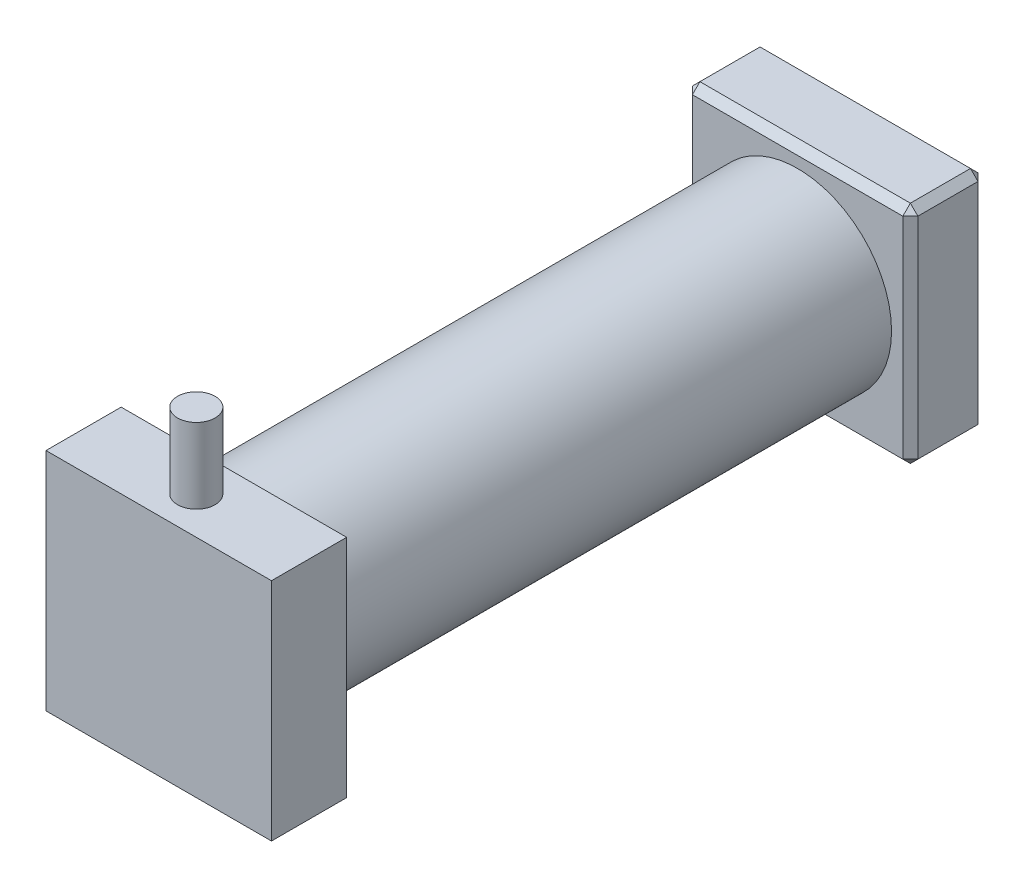
from build123d import *

# Parameters (mm, degrees)
SKETCH1_R           = 25
BOSS_EXTRUDE1_DEPTH = 150
SKETCH2_W           = 60
SKETCH2_H           = 60
BOSS_EXTRUDE2_DEPTH = 20
SKETCH3_W           = 60
SKETCH3_H           = 60
BOSS_EXTRUDE3_DEPTH = 20
SKETCH4_R           = 25
CUT_EXTRUDE1_DEPTH  = 20
SKETCH5_R           = 5
BOSS_EXTRUDE4_DEPTH = 20
CHAMFER1_SIZE       = 2


with BuildPart() as part:
    # Sketch1 → Boss-Extrude1 (new body)
    with BuildSketch(Plane.XY):
        Circle(SKETCH1_R)
    extrude(amount=BOSS_EXTRUDE1_DEPTH)

    # Sketch2 → Boss-Extrude2 (add)
    with BuildSketch(Plane.XY):
        Rectangle(SKETCH2_W, SKETCH2_H)
    extrude(amount=-BOSS_EXTRUDE2_DEPTH)

    # Sketch3 → Boss-Extrude3 (add)
    with BuildSketch(Plane.XY.offset(150)):
        Rectangle(SKETCH3_W, SKETCH3_H)
    extrude(amount=BOSS_EXTRUDE3_DEPTH)

    # Sketch4 → Cut-Extrude1 (cut)
    with BuildSketch(Plane.XY.offset(-20)):
        Circle(SKETCH4_R)
    extrude(amount=CUT_EXTRUDE1_DEPTH, mode=Mode.SUBTRACT)


with BuildPart() as cut_extrude1_piece_1:
    # of the separate pieces the step leaves, piece 1, a body of its own (cut_extrude1_pieces)
    add(part.part.solids().sort_by_distance((-30, -30, 150))[0])

    # Sketch5 → Boss-Extrude4 (add)
    with BuildSketch(Plane(origin=(0, 30, 0), x_dir=(1, 0, 0), z_dir=(0, 1, 0))):
        with Locations((0, -160)):
            Circle(SKETCH5_R)
    extrude(amount=BOSS_EXTRUDE4_DEPTH)


with BuildPart() as cut_extrude1_piece_2:
    # of the separate pieces the step leaves, piece 2, a body of its own (cut_extrude1_pieces)
    add(part.part.solids().sort_by_distance((-30, -30, 0))[0])

    # Chamfer1
    chamfer1_edges = [cut_extrude1_piece_2.edges().sort_by_distance(p)[0] for p in [
        (0, -30, -20),
        (-30, 0, -20),
        (0, 30, -20),
        (30, 0, -20),
        (0, -30, 0),
        (-30, -30, -10),
        (-30, 0, 0),
        (-30, 30, -10),
        (0, 30, 0),
        (30, -30, -10),
        (30, 0, 0),
        (30, 30, -10),
    ]]
    chamfer(chamfer1_edges, length=CHAMFER1_SIZE)


solid = Compound([cut_extrude1_piece_1.part, cut_extrude1_piece_2.part])
